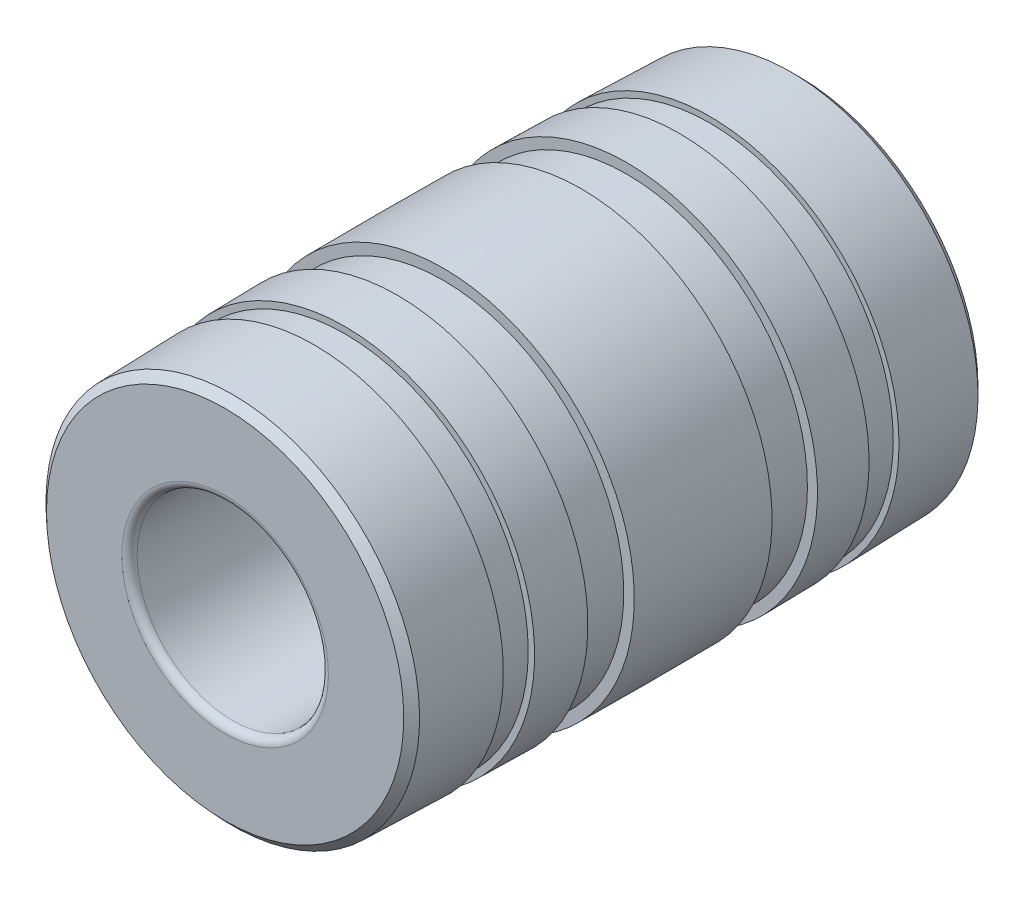
from build123d import *
from OCP.BRepFilletAPI import BRepFilletAPI_MakeChamfer

# Parameters (mm, degrees)
BORE_DEPTH       = 14.090860531
BORE_DEPTH_BACK  = 14.090860531
SKETCH2_R        = 3.175
OD_CHAMFER_SIZE  = 0.254
OD_CHAMFER_SIZE2 = 0.262907157
ID_FILLET_R      = 0.254


with BuildPart() as part:
    # Sketch1 → Bearing (revolve)
    with BuildSketch(Plane(origin=(0, 0, 0), x_dir=(0, 0, -1), z_dir=(1, 0, 0))):
        with BuildLine():
            Line((-9.525, 0), (9.525, 0))
            Line((9.525, 0), (9.525, -6.19125))
            ThreePointArc((9.525, -6.19125), (8.045557875, -6.236743921), (6.5659, -6.274576101))
            Line((6.5659, -6.274576101), (6.5659, -6.084076101))
            Line((6.5659, -6.084076101), (5.5499, -6.084076101))
            Line((5.5499, -6.084076101), (5.5499, -6.296114192))
            ThreePointArc((5.5499, -6.296114192), (4.679971682, -6.311684129), (3.81, -6.324605926))
            Line((3.81, -6.324605926), (3.81, -5.991230926))
            Line((3.81, -5.991230926), (2.286, -5.991230926))
            Line((2.286, -5.991230926), (2.286, -6.340858393))
            ThreePointArc((2.286, -6.340858393), (1.143009139, -6.347714589), (0, -6.35))
            ThreePointArc((0, -6.35), (-1.143009139, -6.347714589), (-2.286, -6.340858393))
            Line((-2.286, -6.340858393), (-2.286, -5.991230926))
            Line((-2.286, -5.991230926), (-3.81, -5.991230926))
            Line((-3.81, -5.991230926), (-3.81, -6.324605926))
            ThreePointArc((-3.81, -6.324605926), (-4.679971682, -6.311684129), (-5.5499, -6.296114192))
            Line((-5.5499, -6.296114192), (-5.5499, -6.084076101))
            Line((-5.5499, -6.084076101), (-6.5659, -6.084076101))
            Line((-6.5659, -6.084076101), (-6.5659, -6.274576101))
            ThreePointArc((-6.5659, -6.274576101), (-8.045557875, -6.236743921), (-9.525, -6.19125))
            Line((-9.525, -6.19125), (-9.525, 0))
        make_face()
    revolve(axis=Axis((0, 0, 9.525), (0, 0, -1)))

    # Sketch2 → Bore (cut, two sides: drawn at the far end of the back side and taken through both)
    with BuildSketch(Plane.XY.offset(-BORE_DEPTH_BACK)):
        Circle(SKETCH2_R)
    extrude(amount=BORE_DEPTH + BORE_DEPTH_BACK, mode=Mode.SUBTRACT)

    # OD Chamfer: one chamfer whose edges measure the first distance from different faces: ONE call of the kernel's chamfer builder (chamfer() names one face for all edges)
    od_chamfer_edges_1 = [part.edges().sort_by_distance(p)[0] for p in [
        (0, 6.19125, 9.525),
    ]]
    od_chamfer_side_1 = [part.faces().sort_by_distance(p)[0] for p in [
        (0, 6.236743921, 8.045557875),
    ]]
    od_chamfer_edges_2 = [part.edges().sort_by_distance(p)[0] for p in [
        (0, 6.19125, -9.525),
    ]]
    od_chamfer_side_2 = [part.faces().sort_by_distance(p)[0] for p in [
        (0, 6.016135006, -9.525),
    ]]
    od_chamfer = BRepFilletAPI_MakeChamfer(part.part.solid().wrapped)
    for e in od_chamfer_edges_1:
        od_chamfer.Add(OD_CHAMFER_SIZE, OD_CHAMFER_SIZE2, e.wrapped, od_chamfer_side_1[0].wrapped)  # the first distance lies on this face
    for e in od_chamfer_edges_2:
        od_chamfer.Add(OD_CHAMFER_SIZE, OD_CHAMFER_SIZE2, e.wrapped, od_chamfer_side_2[0].wrapped)  # the first distance lies on this face
    add(Compound.cast(od_chamfer.Shape()), mode=Mode.REPLACE)

    # ID Fillet
    id_fillet_edges = [part.edges().sort_by_distance(p)[0] for p in [
        (-3.175, 0, -9.525),
        (-3.175, 0, 9.525),
    ]]
    fillet(id_fillet_edges, radius=ID_FILLET_R)


solid = part.part
